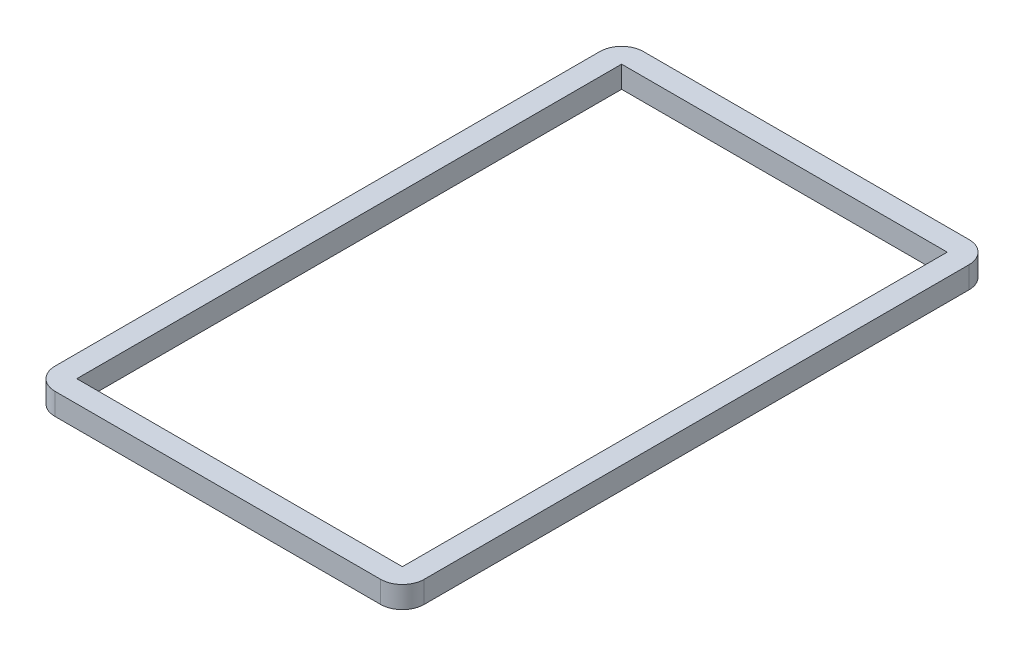
from build123d import *

# Parameters (mm, degrees)
SKETCH1_W           = 44.8
SKETCH1_H           = 74.9625
BOSS_EXTRUDE1_DEPTH = 3


with BuildPart() as part:
    # Sketch1 → Boss-Extrude1 (new body)
    with BuildSketch(Plane(origin=(0, 0, 0), x_dir=(1, 0, 0), z_dir=(0, 1, 0))):
        with BuildLine():
            Line((-22.4, -40.48125), (22.4, -40.48125))
            ThreePointArc((22.4, -40.48125), (24.521320344, -39.602570344), (25.4, -37.48125))
            Line((25.4, -37.48125), (25.4, 37.48125))
            ThreePointArc((25.4, 37.48125), (24.521320344, 39.602570344), (22.4, 40.48125))
            Line((22.4, 40.48125), (-22.4, 40.48125))
            ThreePointArc((-22.4, 40.48125), (-24.521320344, 39.602570344), (-25.4, 37.48125))
            Line((-25.4, 37.48125), (-25.4, -37.48125))
            ThreePointArc((-25.4, -37.48125), (-24.521320344, -39.602570344), (-22.4, -40.48125))
        make_face()
        Rectangle(SKETCH1_W, SKETCH1_H, mode=Mode.SUBTRACT)
    extrude(amount=BOSS_EXTRUDE1_DEPTH)


solid = part.part
